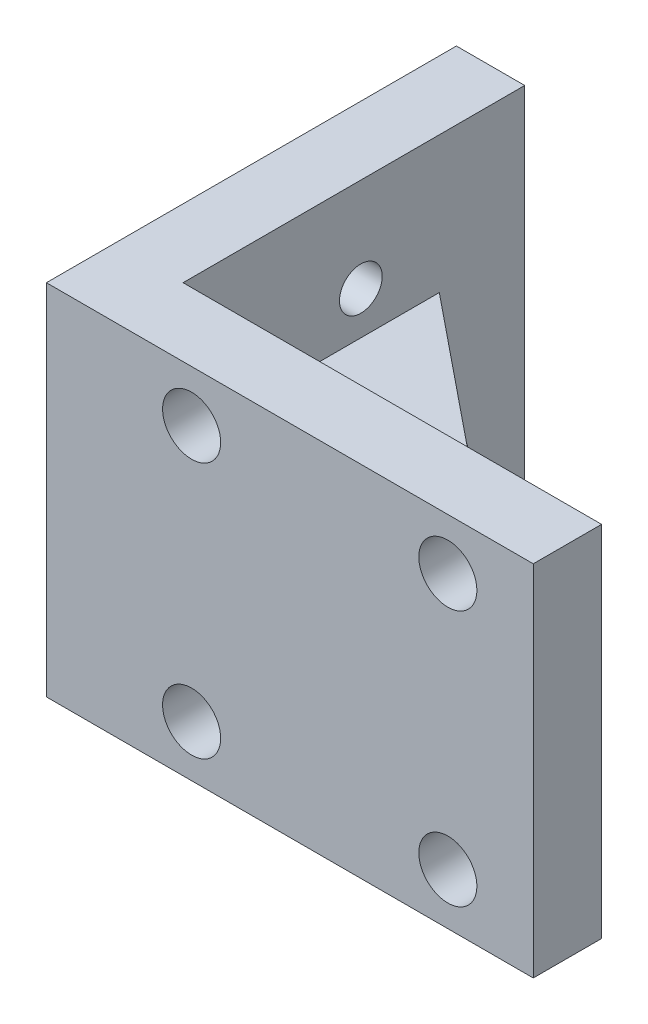
from build123d import *

# Parameters (mm, degrees)
SKETCH_1_W          = 28.5
SKETCH_1_H          = 21
EXTRUDE_1_DEPTH     = 4
SKETCH_2_W          = 4
SKETCH_2_H          = 21
EXTRUDE_2_DEPTH     = 20
RIB_1_REACH         = 38.366
SKETCH_3_WALL_W     = 98.549396912
SKETCH_3_WALL_H     = 5
CUT_EXTRUDE_1_REACH = 42.66
SKETCH_4_R          = 1.25
CUT_EXTRUDE_2_REACH = 44.77
SKETCH_5_R          = 1.7
CUT_EXTRUDE_3_REACH = 39.964
SKETCH_6_R          = 1.7


with BuildPart() as part:
    # 草图1 → 凸台-拉伸1 (new body)
    with BuildSketch(Plane.XY):
        with Locations((14.25, 10.5)):
            Rectangle(SKETCH_1_W, SKETCH_1_H)
    extrude(amount=EXTRUDE_1_DEPTH)

    # 草图2 → 凸台-拉伸2 (add)
    with BuildSketch(Plane(origin=(0, 0, 0), x_dir=(-1, 0, 0), z_dir=(0, 0, -1))):
        with Locations((-2, 10.5)):
            Rectangle(SKETCH_2_W, SKETCH_2_H)
    extrude(amount=EXTRUDE_2_DEPTH)

    # 草图3 wall → 筋1 (add, up to next)
    with BuildSketch(Plane(origin=(13.25, 10.5, -7.5), x_dir=(-0.77675574872, 0, -0.629801958421), z_dir=(0.629801958421, 0, -0.77675574872)), mode=Mode.PRIVATE) as rib_1_sk1:
        Rectangle(SKETCH_3_WALL_W, SKETCH_3_WALL_H)
    rib_1_tool1 = extrude(rib_1_sk1.sketch, amount=-RIB_1_REACH, mode=Mode.PRIVATE) - part.part
    add(rib_1_tool1.solids().sort_by_distance((13.25, 10.5, -7.5))[0])

    # 草图4 → 切除-拉伸1 (cut, up to next)
    with BuildSketch(Plane.ZY, mode=Mode.PRIVATE) as cut_extrude_1_sk1:
        with Locations((-2.406007896, 15.5)):
            Circle(SKETCH_4_R)
    cut_extrude_1_tool1 = extrude(cut_extrude_1_sk1.sketch, amount=-CUT_EXTRUDE_1_REACH, mode=Mode.PRIVATE) & part.part
    # 草图4 → 切除-拉伸1 (cut, up to next)
    with BuildSketch(Plane.ZY, mode=Mode.PRIVATE) as cut_extrude_1_sk2:
        with Locations((-10.406007896, 15.5)):
            Circle(SKETCH_4_R)
    cut_extrude_1_tool2 = extrude(cut_extrude_1_sk2.sketch, amount=-CUT_EXTRUDE_1_REACH, mode=Mode.PRIVATE) & part.part
    add(cut_extrude_1_tool1.solids().sort_by_distance((0, 15.5, -2.406008))[0], mode=Mode.SUBTRACT)
    add(cut_extrude_1_tool2.solids().sort_by_distance((0, 15.5, -10.406008))[0], mode=Mode.SUBTRACT)

    # 草图5 → 切除-拉伸2 (cut, up to next)
    with BuildSketch(Plane.XY.offset(4), mode=Mode.PRIVATE) as cut_extrude_2_sk1:
        with Locations((23.5, 18)):
            Circle(SKETCH_5_R)
    cut_extrude_2_tool1 = extrude(cut_extrude_2_sk1.sketch, amount=-CUT_EXTRUDE_2_REACH, mode=Mode.PRIVATE) & part.part
    # 草图5 → 切除-拉伸2 (cut, up to next)
    with BuildSketch(Plane.XY.offset(4), mode=Mode.PRIVATE) as cut_extrude_2_sk2:
        with Locations((8.5, 3)):
            Circle(SKETCH_5_R)
    cut_extrude_2_tool2 = extrude(cut_extrude_2_sk2.sketch, amount=-CUT_EXTRUDE_2_REACH, mode=Mode.PRIVATE) & part.part
    # 草图5 → 切除-拉伸2 (cut, up to next)
    with BuildSketch(Plane.XY.offset(4), mode=Mode.PRIVATE) as cut_extrude_2_sk3:
        with Locations((23.5, 3)):
            Circle(SKETCH_5_R)
    cut_extrude_2_tool3 = extrude(cut_extrude_2_sk3.sketch, amount=-CUT_EXTRUDE_2_REACH, mode=Mode.PRIVATE) & part.part
    # 草图5 → 切除-拉伸2 (cut, up to next)
    with BuildSketch(Plane.XY.offset(4), mode=Mode.PRIVATE) as cut_extrude_2_sk4:
        with Locations((8.5, 18)):
            Circle(SKETCH_5_R)
    cut_extrude_2_tool4 = extrude(cut_extrude_2_sk4.sketch, amount=-CUT_EXTRUDE_2_REACH, mode=Mode.PRIVATE) & part.part
    add(cut_extrude_2_tool1.solids().sort_by_distance((23.5, 18, 4))[0], mode=Mode.SUBTRACT)
    add(cut_extrude_2_tool2.solids().sort_by_distance((8.5, 3, 4))[0], mode=Mode.SUBTRACT)
    add(cut_extrude_2_tool3.solids().sort_by_distance((23.5, 3, 4))[0], mode=Mode.SUBTRACT)
    add(cut_extrude_2_tool4.solids().sort_by_distance((8.5, 18, 4))[0], mode=Mode.SUBTRACT)

    # 草图6 → 切除-拉伸3 (cut, up to next)
    with BuildSketch(Plane(origin=(4, 0, 0), x_dir=(0, 0, -1), z_dir=(1, 0, 0)), mode=Mode.PRIVATE) as cut_extrude_3_sk1:
        with Locations((5, 4)):
            Circle(SKETCH_6_R)
    cut_extrude_3_tool1 = extrude(cut_extrude_3_sk1.sketch, amount=-CUT_EXTRUDE_3_REACH, mode=Mode.PRIVATE) & part.part
    # 草图6 → 切除-拉伸3 (cut, up to next)
    with BuildSketch(Plane(origin=(4, 0, 0), x_dir=(0, 0, -1), z_dir=(1, 0, 0)), mode=Mode.PRIVATE) as cut_extrude_3_sk2:
        with Locations((15, 4)):
            Circle(SKETCH_6_R)
    cut_extrude_3_tool2 = extrude(cut_extrude_3_sk2.sketch, amount=-CUT_EXTRUDE_3_REACH, mode=Mode.PRIVATE) & part.part
    add(cut_extrude_3_tool1.solids().sort_by_distance((4, 4, -5))[0], mode=Mode.SUBTRACT)
    add(cut_extrude_3_tool2.solids().sort_by_distance((4, 4, -15))[0], mode=Mode.SUBTRACT)


solid = part.part
